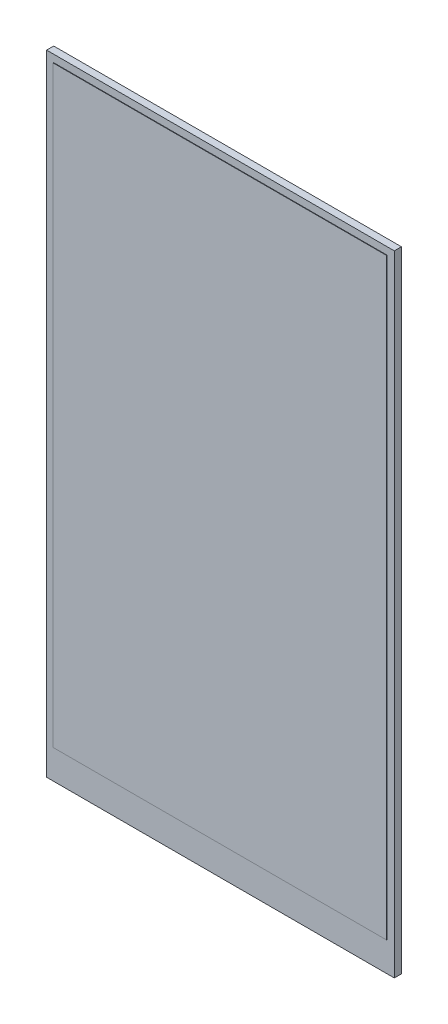
from build123d import *

# Parameters (mm, degrees)
ESQUISSE1_W        = 70.94
ESQUISSE1_H        = 128.49
BOSS_EXTRU_1_DEPTH = 1.45
ESQUISSE2_W        = 68.04
ESQUISSE2_H        = 120.96
BOSS_EXTRU_2_DEPTH = 0.1


with BuildPart() as part:
    # Esquisse1 → Boss.-Extru.1 (new body)
    with BuildSketch(Plane.XY):
        with Locations((35.47, 64.245)):
            Rectangle(ESQUISSE1_W, ESQUISSE1_H)
    extrude(amount=BOSS_EXTRU_1_DEPTH)

    # Esquisse2 → Boss.-Extru.2 (add)
    with BuildSketch(Plane.XY.offset(1.45)):
        with Locations((35.47, 66.51)):
            Rectangle(ESQUISSE2_W, ESQUISSE2_H)
    extrude(amount=BOSS_EXTRU_2_DEPTH)


solid = part.part
